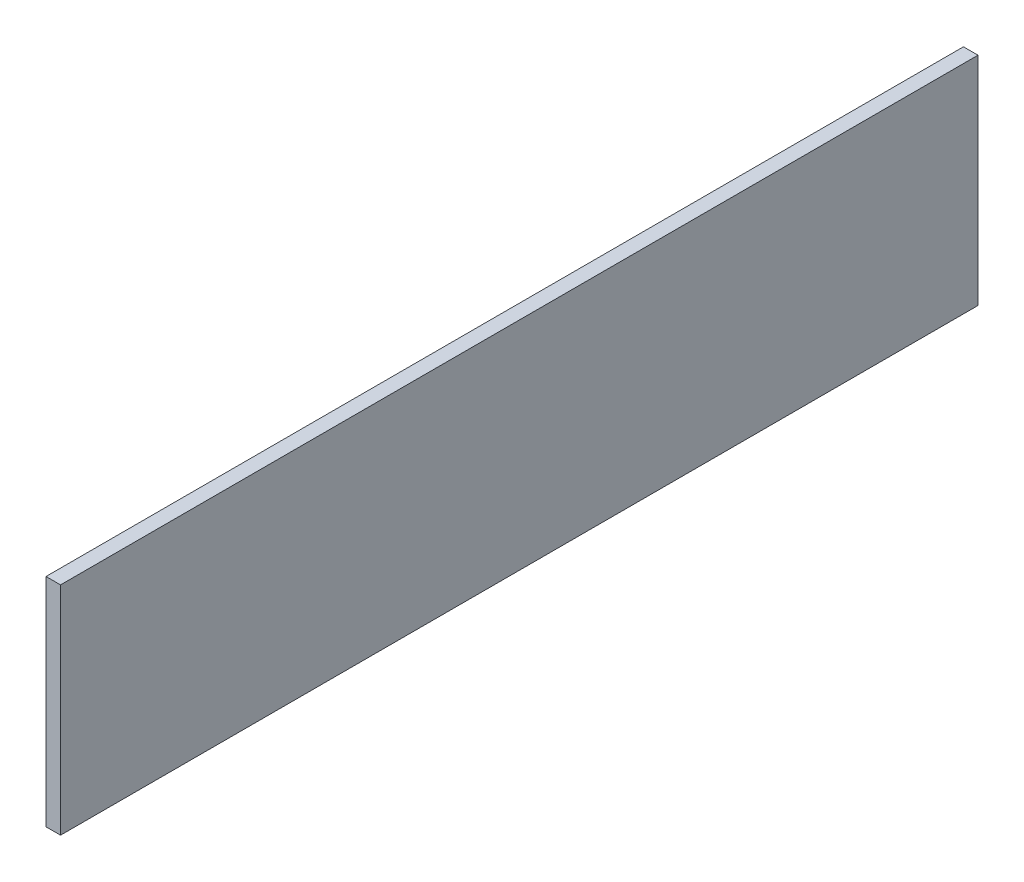
from build123d import *

# Parameters (mm, degrees)
SKETCH1_W                   = 12
SKETCH1_H                   = 179
DET2_BOLME_SACI_SOL_1_DEPTH = 757.5


with BuildPart() as part:
    # Sketch1 → DET2_bolme_saci_sol_1 (new body)
    with BuildSketch(Plane.XY):
        with Locations((708, 1558.5)):
            Rectangle(SKETCH1_W, SKETCH1_H)
    extrude(amount=-DET2_BOLME_SACI_SOL_1_DEPTH)


solid = part.part
